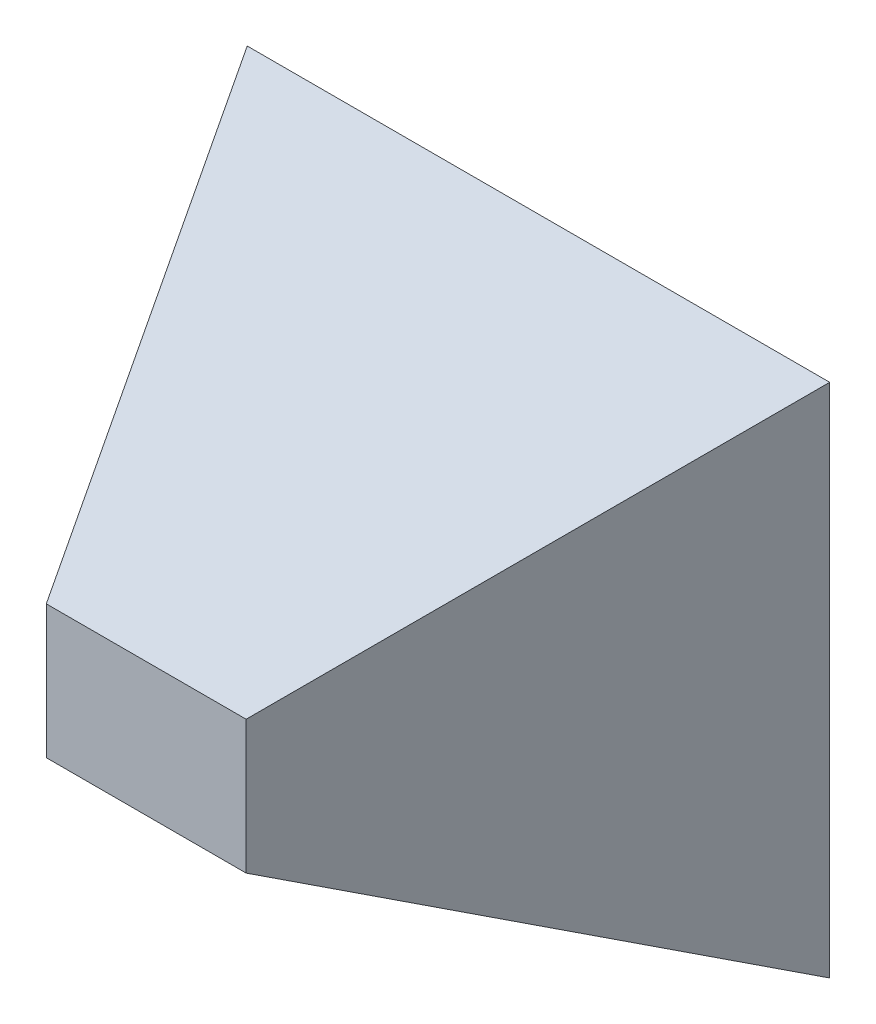
from build123d import *

# Parameters (mm, degrees)
SKETCH1_W           = 350
SKETCH1_H           = 310
BOSS_EXTRUDE1_DEPTH = 235.7
BOSS_EXTRUDE1_TAPER = 26
SHELL1_T            = -1
SKETCH3_W           = 346
SKETCH3_H           = 306
CUT_EXTRUDE1_DEPTH  = 2


with BuildPart() as part:
    # Sketch1 → Boss-Extrude1 (new body)
    with BuildSketch(Plane.XY):
        Rectangle(SKETCH1_W, SKETCH1_H)
    extrude(amount=BOSS_EXTRUDE1_DEPTH, taper=BOSS_EXTRUDE1_TAPER)

    # Shell1
    shell1_openings = [part.faces().sort_by_distance(p)[0] for p in [
        (0, 0, 0),
    ]]
    offset(amount=SHELL1_T, openings=shell1_openings, kind=Kind.INTERSECTION)

    # Sketch3 → Cut-Extrude1 (cut)
    with BuildSketch(Plane(origin=(0, 0, 0), x_dir=(-1, 0, 0), z_dir=(0, 0, -1))):
        Rectangle(SKETCH3_W, SKETCH3_H)
    extrude(amount=-CUT_EXTRUDE1_DEPTH, mode=Mode.SUBTRACT)


solid = part.part
